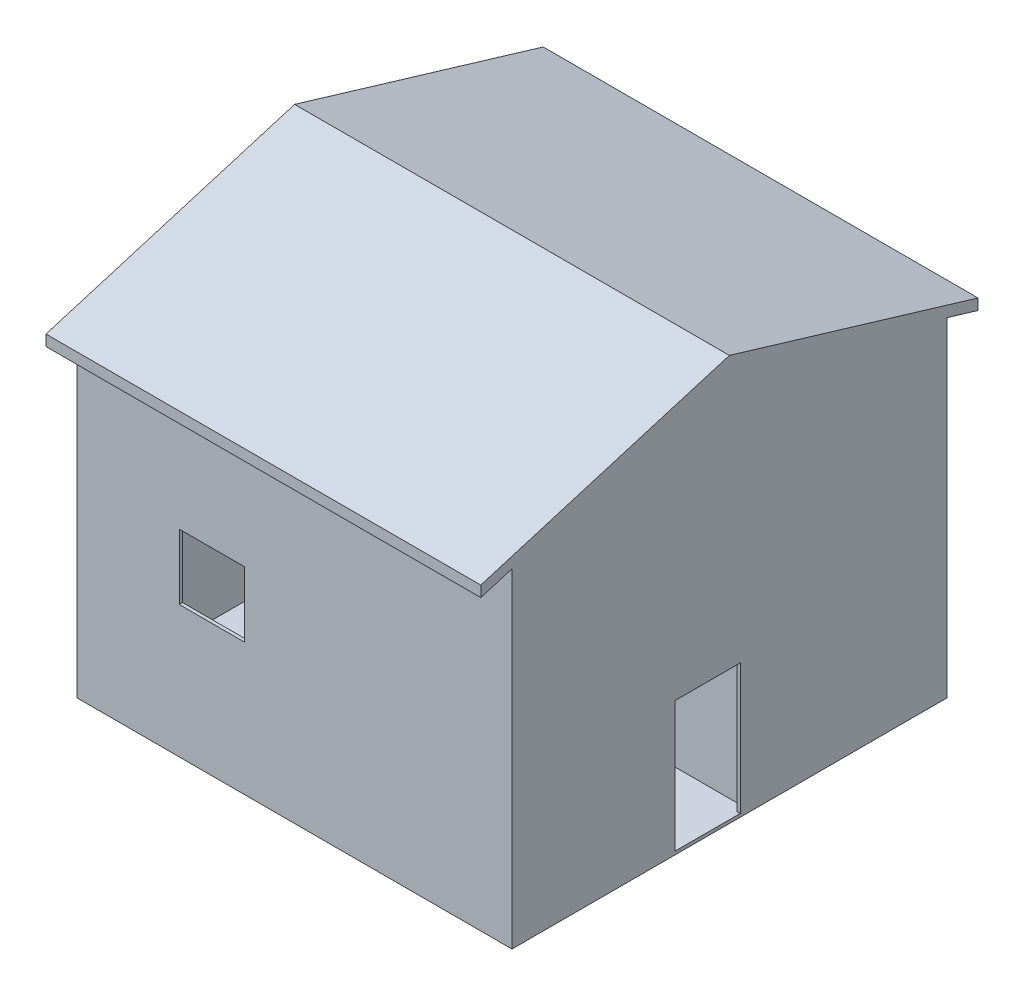
from build123d import *

# Parameters (mm, degrees)
SKETCH_1_W           = 150
SKETCH_1_H           = 3.5
EXTRUDE_1_DEPTH      = 1.5
SKETCH_2_W           = 121.171669679
SKETCH_2_H           = 150
EXTRUDE_2_DEPTH      = 91.5
SKETCH_3_W           = 1.5
SKETCH_3_H           = 90
EXTRUDE_3_DEPTH      = 30
EXTRUDE_4_DEPTH      = 30
SKETCH_5_W           = 151.171669679
SKETCH_5_H           = 125
EXTRUDE_5_DEPTH      = 1.5
SKETCH_6_W           = 125
SKETCH_6_H           = 151.5
EXTRUDE_6_DEPTH      = 48.828330321
SKETCH_7_W           = 200
SKETCH_7_H           = 151.5
EXTRUDE_7_DEPTH      = 75
SKETCH_8_W           = 74.671669679
SKETCH_8_H           = 150
CUT_EXTRUDE_1_DEPTH  = 53.5
SKETCH_9_W           = 30
SKETCH_9_H           = 150
CUT_EXTRUDE_2_DEPTH  = 59.25
SKETCH_10_W          = 59.25
SKETCH_10_H          = 150
CUT_EXTRUDE_3_DEPTH  = 42.671669679
SKETCH_11_W          = 30
SKETCH_11_H          = 60
CUT_EXTRUDE_4_DEPTH  = 1.5
SKETCH_12_W          = 30
SKETCH_12_H          = 60
CUT_EXTRUDE_5_DEPTH  = 1.5
SKETCH_13_W          = 87
SKETCH_13_H          = 150
CUT_EXTRUDE_6_DEPTH  = 47.328330321
SKETCH_14_W          = 59.25
SKETCH_14_H          = 150
CUT_EXTRUDE_7_DEPTH  = 47.328330321
SKETCH_15_W          = 120
SKETCH_15_H          = 150
CUT_EXTRUDE_8_DEPTH  = 29.25
SKETCH_16_W          = 88.5
SKETCH_16_H          = 150
CUT_EXTRUDE_9_DEPTH  = 75.5
SKETCH_17_W          = 122
SKETCH_17_H          = 150
CUT_EXTRUDE_10_DEPTH = 20
SKETCH_18_W          = 50
SKETCH_18_H          = 150
CUT_EXTRUDE_11_DEPTH = 73.5
SKETCH_19_W          = 73.5
SKETCH_19_H          = 150
CUT_EXTRUDE_12_DEPTH = 18.5
SKETCH_20_W          = 75
SKETCH_20_H          = 150
CUT_EXTRUDE_13_DEPTH = 3.5
CUT_EXTRUDE_14_REACH = 272.097
SKETCH_21_W          = 30
SKETCH_21_H          = 30
CUT_EXTRUDE_15_REACH = 272.097
SKETCH_22_W          = 30
SKETCH_22_H          = 30
CUT_EXTRUDE_16_REACH = 272.097
SKETCH_23_W          = 30
SKETCH_23_H          = 30
EXTRUDE_11_DEPTH     = 200
EXTRUDE_12_DEPTH     = 200


with BuildPart() as part:
    # 草圖1 → 填料-伸長1 (new body)
    with BuildSketch(Plane(origin=(98.5, 0, 0), x_dir=(0, -1, 0), z_dir=(-1, 0, 0))):
        with Locations((-76.5, -6.75)):
            Rectangle(SKETCH_1_W, SKETCH_1_H)
    extrude(amount=-EXTRUDE_1_DEPTH)

    # 草圖2 → 填料-伸長2 (add)
    with BuildSketch(Plane(origin=(0, 0, -8.5), x_dir=(-1, 0, 0), z_dir=(0, 0, -1))):
        with Locations((-39.41416516, 76.5)):
            Rectangle(SKETCH_2_W, SKETCH_2_H)
    extrude(amount=EXTRUDE_2_DEPTH)

    # 草圖3 → 填料-伸長3 (add)
    with BuildSketch(Plane.XY.offset(-5)):
        with Locations((99.25, 106.5)):
            Rectangle(SKETCH_3_W, SKETCH_3_H)
    extrude(amount=EXTRUDE_3_DEPTH)

    # 草圖4 → 填料-伸長4 (add)
    with BuildSketch(Plane.ZY.offset(21.171669679)):
        Polygon((-100, 1.5), (-100, 151.5), (-8.5, 151.5), (-8.5, 61.5), (-10, 61.5), (-10, 1.5), align=None)
    extrude(amount=EXTRUDE_4_DEPTH)

    # 草圖5 → 填料-伸長5 (add)
    with BuildSketch(Plane.XZ.offset(-1.5)):
        with Locations((24.41416516, -37.5)):
            Rectangle(SKETCH_5_W, SKETCH_5_H)
    extrude(amount=EXTRUDE_5_DEPTH)

    # 草圖6 → 填料-伸長6 (add)
    with BuildSketch(Plane.ZY.offset(51.171669679)):
        with Locations((-37.5, 75.75)):
            Rectangle(SKETCH_6_W, SKETCH_6_H)
    extrude(amount=EXTRUDE_6_DEPTH)

    # 草圖7 → 填料-伸長7 (add)
    with BuildSketch(Plane.XY.offset(25)):
        with Locations((0, 75.75)):
            Rectangle(SKETCH_7_W, SKETCH_7_H)
    extrude(amount=EXTRUDE_7_DEPTH)

    # 草圖8 → 除料-伸長1 (cut)
    with BuildSketch(Plane(origin=(0, 0, 25), x_dir=(-1, 0, 0), z_dir=(0, 0, -1))):
        with Locations((13.83583484, 76.5)):
            Rectangle(SKETCH_8_W, SKETCH_8_H)
    extrude(amount=-CUT_EXTRUDE_1_DEPTH, mode=Mode.SUBTRACT)

    # 草圖9 → 除料-伸長2 (cut)
    with BuildSketch(Plane.XY.offset(-10)):
        with Locations((-36.171669679, 76.5)):
            Rectangle(SKETCH_9_W, SKETCH_9_H)
    extrude(amount=-CUT_EXTRUDE_2_DEPTH, mode=Mode.SUBTRACT)

    # 草圖10 → 除料-伸長3 (cut)
    with BuildSketch(Plane.ZY.offset(21.171669679)):
        with Locations((-39.625, 76.5)):
            Rectangle(SKETCH_10_W, SKETCH_10_H)
    extrude(amount=-CUT_EXTRUDE_3_DEPTH, mode=Mode.SUBTRACT)

    # 草圖11 → 除料-伸長4 (cut)
    with BuildSketch(Plane.ZY.offset(-23.5)):
        with Locations((63.5, 31.5)):
            Rectangle(SKETCH_11_W, SKETCH_11_H)
    extrude(amount=-CUT_EXTRUDE_4_DEPTH, mode=Mode.SUBTRACT)

    # 草圖12 → 除料-伸長5 (cut)
    with BuildSketch(Plane.ZY.offset(-21.5)):
        with Locations((-54.25, 31.5)):
            Rectangle(SKETCH_12_W, SKETCH_12_H)
    extrude(amount=-CUT_EXTRUDE_5_DEPTH, mode=Mode.SUBTRACT)

    # 草圖13 → 除料-伸長6 (cut)
    with BuildSketch(Plane(origin=(-51.171669679, 0, 0), x_dir=(0, 0, -1), z_dir=(1, 0, 0))):
        with Locations((-35, 76.5)):
            Rectangle(SKETCH_13_W, SKETCH_13_H)
    extrude(amount=-CUT_EXTRUDE_6_DEPTH, mode=Mode.SUBTRACT)

    # 草圖14 → 除料-伸長7 (cut)
    with BuildSketch(Plane(origin=(-51.171669679, 0, 0), x_dir=(0, 0, -1), z_dir=(1, 0, 0))):
        with Locations((39.625, 76.5)):
            Rectangle(SKETCH_14_W, SKETCH_14_H)
    extrude(amount=-CUT_EXTRUDE_7_DEPTH, mode=Mode.SUBTRACT)

    # 草圖15 → 除料-伸長8 (cut)
    with BuildSketch(Plane.XY.offset(-69.25)):
        with Locations((-38.5, 76.5)):
            Rectangle(SKETCH_15_W, SKETCH_15_H)
    extrude(amount=-CUT_EXTRUDE_8_DEPTH, mode=Mode.SUBTRACT)

    # 草圖16 → 除料-伸長9 (cut)
    with BuildSketch(Plane.ZY.offset(-23)):
        with Locations((-54.25, 76.5)):
            Rectangle(SKETCH_16_W, SKETCH_16_H)
    extrude(amount=-CUT_EXTRUDE_9_DEPTH, mode=Mode.SUBTRACT)

    # 草圖17 → 除料-伸長10 (cut)
    with BuildSketch(Plane(origin=(0, 0, 78.5), x_dir=(-1, 0, 0), z_dir=(0, 0, -1))):
        with Locations((37.5, 76.5)):
            Rectangle(SKETCH_17_W, SKETCH_17_H)
    extrude(amount=-CUT_EXTRUDE_10_DEPTH, mode=Mode.SUBTRACT)

    # 草圖18 → 除料-伸長11 (cut)
    with BuildSketch(Plane.ZY.offset(-25)):
        with Locations((73.5, 76.5)):
            Rectangle(SKETCH_18_W, SKETCH_18_H)
    extrude(amount=-CUT_EXTRUDE_11_DEPTH, mode=Mode.SUBTRACT)

    # 草圖19 → 除料-伸長12 (cut)
    with BuildSketch(Plane.XY.offset(48.5)):
        with Locations((61.75, 76.5)):
            Rectangle(SKETCH_19_W, SKETCH_19_H)
    extrude(amount=-CUT_EXTRUDE_12_DEPTH, mode=Mode.SUBTRACT)

    # 草圖20 → 除料-伸長13 (cut)
    with BuildSketch(Plane(origin=(0, 0, 25), x_dir=(-1, 0, 0), z_dir=(0, 0, -1))):
        with Locations((-61, 76.5)):
            Rectangle(SKETCH_20_W, SKETCH_20_H)
    extrude(amount=-CUT_EXTRUDE_13_DEPTH, mode=Mode.SUBTRACT)

    # 草圖21 → 除料-伸長14 (cut, up to next)
    with BuildSketch(Plane(origin=(0, 0, -100), x_dir=(-1, 0, 0), z_dir=(0, 0, -1)), mode=Mode.PRIVATE) as cut_extrude_14_sk1:
        with Locations((-52.804007689, 60.155834385)):
            Rectangle(SKETCH_21_W, SKETCH_21_H)
    cut_extrude_14_tool1 = extrude(cut_extrude_14_sk1.sketch, amount=-CUT_EXTRUDE_14_REACH, mode=Mode.PRIVATE) & part.part
    add(cut_extrude_14_tool1.solids().sort_by_distance((52.804008, 60.155834, -100))[0], mode=Mode.SUBTRACT)

    # 草圖22 → 除料-伸長15 (cut, up to next)
    with BuildSketch(Plane(origin=(0, 0, -100), x_dir=(-1, 0, 0), z_dir=(0, 0, -1)), mode=Mode.PRIVATE) as cut_extrude_15_sk1:
        with Locations((36.226594007, 60.594472186)):
            Rectangle(SKETCH_22_W, SKETCH_22_H)
    cut_extrude_15_tool1 = extrude(cut_extrude_15_sk1.sketch, amount=-CUT_EXTRUDE_15_REACH, mode=Mode.PRIVATE) & part.part
    add(cut_extrude_15_tool1.solids().sort_by_distance((-36.226594, 60.594472, -100))[0], mode=Mode.SUBTRACT)

    # 草圖23 → 除料-伸長16 (cut, up to next)
    with BuildSketch(Plane.XY.offset(100), mode=Mode.PRIVATE) as cut_extrude_16_sk1:
        with Locations((-38.061358281, 75.75)):
            Rectangle(SKETCH_23_W, SKETCH_23_H)
    cut_extrude_16_tool1 = extrude(cut_extrude_16_sk1.sketch, amount=-CUT_EXTRUDE_16_REACH, mode=Mode.PRIVATE) & part.part
    add(cut_extrude_16_tool1.solids().sort_by_distance((-38.061358, 75.75, 100))[0], mode=Mode.SUBTRACT)



with BuildPart() as body_2:
    # 草圖26 → 填料-伸長11 (new body)
    with BuildSketch(Plane(origin=(100, 0, 0), x_dir=(0, 0, -1), z_dir=(1, 0, 0))):
        Polygon((-100, 151.5), (0, 181.5), (100, 151.5), (114.367394278, 147.189781717), (114.367394278, 152.189781717), (0, 186.5), (-114.367394278, 152.189781717), (-114.367394278, 147.189781717), align=None)
    extrude(amount=-EXTRUDE_11_DEPTH)


with BuildPart() as part_1:
    add(part.part)

    add(body_2.part)  # 填料-伸長12 merges body 2
    # 草圖27 → 填料-伸長12 (add)
    with BuildSketch(Plane(origin=(100, 0, 0), x_dir=(0, 0, -1), z_dir=(1, 0, 0))):
        Polygon((0, 181.5), (-100, 151.5), (0, 151.5), (100, 151.5), align=None)
    extrude(amount=-EXTRUDE_12_DEPTH)


solid = part_1.part
